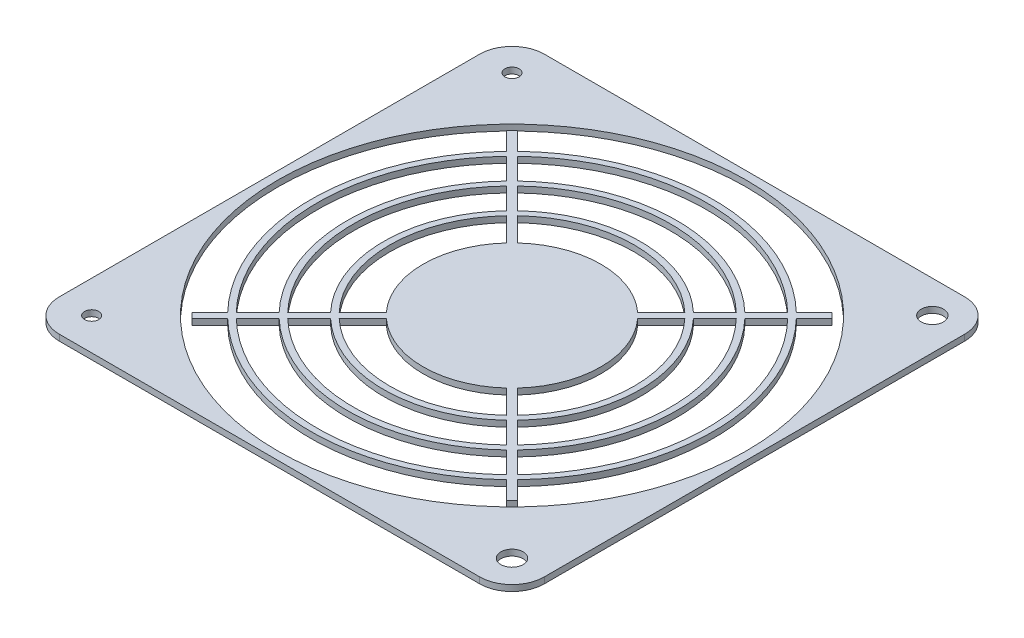
from build123d import *

# Parameters (mm, degrees)
SKETCH_1_R      = 2.75
SKETCH_1_R_2    = 1.75
SKETCH_1_R_3    = 58
EXTRUDE_1_DEPTH = 1.5
SKETCH_2_R      = 22
EXTRUDE_2_DEPTH = 1.5
SKETCH_3_R      = 31.75
SKETCH_3_R_2    = 30.25
EXTRUDE_3_DEPTH = 1.5
SKETCH_4_R      = 40.75
SKETCH_4_R_2    = 39.25
EXTRUDE_4_DEPTH = 1.5
SKETCH_5_R      = 49.75
SKETCH_5_R_2    = 48.25
EXTRUDE_5_DEPTH = 1.5
SKETCH_5_2_R    = 49.75
SKETCH_5_2_R_2  = 48.25
EXTRUDE_6_DEPTH = 1.5
SKETCH_5_3_R    = 49.75
SKETCH_5_3_R_2  = 48.25
EXTRUDE_7_DEPTH = 1.5
EXTRUDE_8_DEPTH = 1.5
EXTRUDE_9_DEPTH = 1.5


with BuildPart() as part:
    # 草图1 → 凸台-拉伸1 (new body)
    with BuildSketch(Plane(origin=(0, 0, 0), x_dir=(1, 0, 0), z_dir=(0, 1, 0))):
        with BuildLine():
            Line((-52, 60), (52, 60))
            ThreePointArc((52, 60), (57.656854249, 57.656854249), (60, 52))
            Line((60, 52), (60, -52))
            ThreePointArc((60, -52), (57.656854249, -57.656854249), (52, -60))
            Line((52, -60), (-52, -60))
            ThreePointArc((-52, -60), (-57.656854249, -57.656854249), (-60, -52))
            Line((-60, -52), (-60, 52))
            ThreePointArc((-60, 52), (-57.656854249, 57.656854249), (-52, 60))
        make_face()
        with Locations((52, 52)):
            Circle(SKETCH_1_R, mode=Mode.SUBTRACT)
        with Locations((52, -52)):
            Circle(SKETCH_1_R, mode=Mode.SUBTRACT)
        with Locations((-52, 52)):
            Circle(SKETCH_1_R_2, mode=Mode.SUBTRACT)
        with Locations((-52, -52)):
            Circle(SKETCH_1_R_2, mode=Mode.SUBTRACT)
        Circle(SKETCH_1_R_3, mode=Mode.SUBTRACT)
    extrude(amount=EXTRUDE_1_DEPTH)


with BuildPart() as body_2:
    # 草图2 → 凸台-拉伸2 (new body)
    with BuildSketch(Plane(origin=(0, 0, 0), x_dir=(1, 0, 0), z_dir=(0, 1, 0))):
        Circle(SKETCH_2_R)
    extrude(amount=EXTRUDE_2_DEPTH)



with BuildPart() as body_3:
    # 草图3 → 凸台-拉伸3 (new body)
    with BuildSketch(Plane(origin=(0, 0, 0), x_dir=(1, 0, 0), z_dir=(0, 1, 0))):
        Circle(SKETCH_3_R)
        Circle(SKETCH_3_R_2, mode=Mode.SUBTRACT)
    extrude(amount=EXTRUDE_3_DEPTH)


with BuildPart() as body_4:
    # 草图4 → 凸台-拉伸4 (new body)
    with BuildSketch(Plane(origin=(0, 0, 0), x_dir=(1, 0, 0), z_dir=(0, 1, 0))):
        Circle(SKETCH_4_R)
        Circle(SKETCH_4_R_2, mode=Mode.SUBTRACT)
    extrude(amount=EXTRUDE_4_DEPTH)


with BuildPart() as body_5:
    # 草图5 → 凸台-拉伸5 (new body)
    with BuildSketch(Plane(origin=(0, 0, 0), x_dir=(1, 0, 0), z_dir=(0, 1, 0))):
        Circle(SKETCH_5_R)
        Circle(SKETCH_5_R_2, mode=Mode.SUBTRACT)
    extrude(amount=EXTRUDE_5_DEPTH)

    # 草图5<2> → 凸台-拉伸6 (add)
    with BuildSketch(Plane(origin=(0, 0, 0), x_dir=(1, 0, 0), z_dir=(0, 1, 0))):
        Circle(SKETCH_5_2_R)
        Circle(SKETCH_5_2_R_2, mode=Mode.SUBTRACT)
    extrude(amount=EXTRUDE_6_DEPTH)

    # 草图5<3> → 凸台-拉伸7 (add)
    with BuildSketch(Plane(origin=(0, 0, 0), x_dir=(1, 0, 0), z_dir=(0, 1, 0))):
        Circle(SKETCH_5_3_R)
        Circle(SKETCH_5_3_R_2, mode=Mode.SUBTRACT)
    extrude(amount=EXTRUDE_7_DEPTH)


with BuildPart() as body_2_1:
    add(body_2.part)

    add(body_3.part)  # 凸台-拉伸8 merges body 3

    add(body_4.part)  # 凸台-拉伸8 merges body 4

    add(body_5.part)  # 凸台-拉伸8 merges body 5
    # 草图8 → 凸台-拉伸8 (add)
    with BuildSketch(Plane(origin=(0, 0, 0), x_dir=(1, 0, 0), z_dir=(0, 1, 0))):
        Polygon((-38.926228304, -40.269731189), (40.269731189, 38.926228304), (38.926228304, 40.269731189), (-40.269731189, -38.926228304), align=None)
    extrude(amount=EXTRUDE_8_DEPTH)

    # 草图9 → 凸台-拉伸9 (add)
    with BuildSketch(Plane(origin=(0, 0, 0), x_dir=(1, 0, 0), z_dir=(0, 1, 0))):
        Polygon((40.269731189, -38.926228304), (-38.926228304, 40.269731189), (-40.269731189, 38.926228304), (38.926228304, -40.269731189), align=None)
    extrude(amount=EXTRUDE_9_DEPTH)


solid = Compound([part.part, body_2_1.part])
